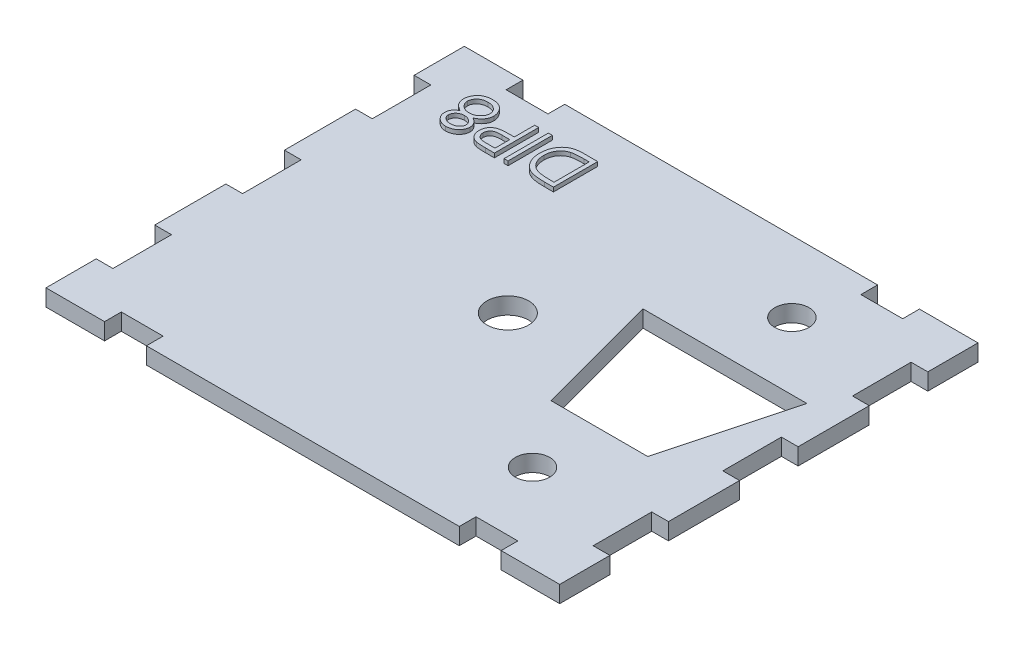
from build123d import *

# Parameters (mm, degrees)
SKETCH2_W           = 100
SKETCH2_H           = 50
BOSS_EXTRUDE1_DEPTH = 2
SKETCH12_W          = 9.8
SKETCH12_H          = 50
SKETCH12_W_2        = 8.8
CUT_EXTRUDE8_DEPTH  = 6
SKETCH13_W          = 2
SKETCH13_H          = 7
SKETCH13_W_2        = 5
SKETCH13_H_2        = 2
CUT_EXTRUDE10_DEPTH = 6
SKETCH15_W          = 6.543059906
SKETCH15_H          = 1
CUT_EXTRUDE13_DEPTH = 10
SKETCH16_R          = 2.5
CUT_EXTRUDE14_DEPTH = 10
SKETCH17_R          = 2.05
CUT_EXTRUDE15_DEPTH = 3.5
SKETCH22_W          = 0.474893163
SKETCH22_H          = 5.291666667
BOSS_EXTRUDE4_DEPTH = 0.5


with BuildPart() as part:
    # Sketch2 → Boss-Extrude1 (new body)
    with BuildSketch(Plane(origin=(0, 0, 0), x_dir=(1, 0, 0), z_dir=(0, 1, 0))):
        Rectangle(SKETCH2_W, SKETCH2_H)
    extrude(amount=BOSS_EXTRUDE1_DEPTH)

    # Sketch12 → Cut-Extrude8 (cut)
    with BuildSketch(Plane(origin=(0, 2, 0), x_dir=(1, 0, 0), z_dir=(0, 1, 0))):
        with Locations((-45.1, 0)):
            Rectangle(SKETCH12_W, SKETCH12_H)
        with Locations((45.6, 0)):
            Rectangle(SKETCH12_W_2, SKETCH12_H)
    extrude(amount=-CUT_EXTRUDE8_DEPTH, mode=Mode.SUBTRACT)

    # Sketch13 → Cut-Extrude10 (cut)
    with BuildSketch(Plane(origin=(0, 2, 0), x_dir=(1, 0, 0), z_dir=(0, 1, 0))):
        with Locations((-29.2, 0)):
            Rectangle(SKETCH13_W, SKETCH13_H)
        Polygon((-30.2, 12), (-30.2, 19), (-30.2, 25), (-40.2, 25), (-40.2, -25), (-30.2, -25), (-30.2, -19), (-30.2, -12), (-30.2, -3.5), (-30.2, 3.5), align=None)
        with Locations((-29.2, 15.5)):
            Rectangle(SKETCH13_W, SKETCH13_H)
        with Locations((21.7, -24)):
            Rectangle(SKETCH13_W_2, SKETCH13_H_2)
        with Locations((30.2, -15.5)):
            Rectangle(SKETCH13_W, SKETCH13_H)
        with Locations((30.2, 0)):
            Rectangle(SKETCH13_W, SKETCH13_H)
        with Locations((30.2, 15.5)):
            Rectangle(SKETCH13_W, SKETCH13_H)
        with Locations((21.7, 24)):
            Rectangle(SKETCH13_W_2, SKETCH13_H_2)
        with Locations((-29.2, -15.5)):
            Rectangle(SKETCH13_W, SKETCH13_H)
        Polygon((41.2, 25), (31.2, 25), (31.2, 19), (31.2, 12), (31.2, 3.5), (31.2, -3.5), (31.2, -12), (31.2, -19), (31.2, -25), (41.2, -25), align=None)
        with Locations((-20.7, 24)):
            Rectangle(SKETCH13_W_2, SKETCH13_H_2)
        with Locations((-20.7, -24)):
            Rectangle(SKETCH13_W_2, SKETCH13_H_2)
    extrude(amount=-CUT_EXTRUDE10_DEPTH, mode=Mode.SUBTRACT)

    # Sketch15 → Cut-Extrude13 (cut)
    with BuildSketch(Plane.XZ):
        Polygon((8.96933351, -7.5), (14.181143059, -7.5), (20.724202965, -7.5), (25.936012514, -7.5), (22.452673012, 5.5), (12.452673012, 5.5), align=None)
        Polygon((27.239237886, -8.5), (20.724202965, -8.5), (20.724202965, -7.5), (25.936012514, -7.5), (22.452673012, 5.5), (12.452673012, 5.5), (8.96933351, -7.5), (14.181143059, -7.5), (14.181143059, -8.5), (7.666108138, -8.5), (11.685346024, 6.5), (23.22, 6.5), align=None)
        with Locations((17.452673012, -8)):
            Rectangle(SKETCH15_W, SKETCH15_H)
    extrude(amount=-CUT_EXTRUDE13_DEPTH, mode=Mode.SUBTRACT)

    # Sketch16 → Cut-Extrude14 (cut)
    with BuildSketch(Plane(origin=(0, 0, 0), x_dir=(-1, 0, 0), z_dir=(0, -1, 0))):
        with Locations(Location((0, 0, 0), (0, 0, 90))):
            Circle(SKETCH16_R)
    extrude(amount=-CUT_EXTRUDE14_DEPTH, mode=Mode.SUBTRACT)

    # Sketch17 → Cut-Extrude15 (cut)
    with BuildSketch(Plane(origin=(0, 0, 0), x_dir=(-1, 0, 0), z_dir=(0, -1, 0))):
        with Locations(Location((-17.452672874, -14.5, 0), (0, 0, 90))):
            Circle(SKETCH17_R)
        with Locations(Location((-17.452672903, 16.5, 0), (0, 0, 90))):
            Circle(SKETCH17_R)
    extrude(amount=-CUT_EXTRUDE15_DEPTH, mode=Mode.SUBTRACT)

    # Sketch22 → Boss-Extrude4 (add)
    # profile 1 of 4: a face of its own
    with BuildSketch(Plane(origin=(0, 2, 0), x_dir=(1, 0, 0), z_dir=(0, 1, 0))):
        with BuildLine():
            add(Edge.make_bspline(
                [(-23.289435803, 17.591903377), (-23.332404905, 17.61448406), (-23.416471147, 17.658661691), (-23.536226688, 17.730009944), (-23.647999479, 17.802604298), (-23.749722211, 17.879054809), (-23.842392171, 17.957736407), (-23.926294543, 18.038440897), (-24.002331643, 18.120913039), (-24.067891265, 18.207273039), (-24.126059508, 18.295985161), (-24.175335145, 18.388142762), (-24.218340263, 18.482414147), (-24.252093921, 18.580230551), (-24.279961434, 18.680250068), (-24.299121538, 18.783814795), (-24.309429202, 18.890228595), (-24.31137761, 18.962147422), (-24.312364155, 18.998562365)],
                knots=[0, 0, 0, 0, 1.264219729, 2.473363326, 3.62979159, 4.734286947, 5.785533755, 6.79450939, 7.765315851, 8.704182021, 9.615576613, 10.525715488, 11.423813905, 12.311666436, 13.218214638, 14.126256791, 15.051260205, 16, 16, 16, 16], degree=3))
            add(Edge.make_bspline(
                [(-24.312364155, 18.998562365), (-24.311204378, 19.049512323), (-24.308908743, 19.150361407), (-24.288705392, 19.299170633), (-24.258862371, 19.444279836), (-24.213527962, 19.584044036), (-24.15774182, 19.719654049), (-24.087347083, 19.849282845), (-24.007897509, 19.976651469), (-23.944003353, 20.054992402), (-23.911673049, 20.094632744)],
                knots=[0, 0, 0, 0, 1.02531512, 2.029483338, 3.018748588, 4.004195107, 4.983200899, 5.966616707, 6.971112471, 8, 8, 8, 8], degree=3))
            add(Edge.make_bspline(
                [(-23.911673049, 20.094632744), (-23.869586951, 20.140887617), (-23.785934825, 20.232825779), (-23.642632065, 20.352191884), (-23.485360884, 20.452505849), (-23.314729833, 20.534257404), (-23.131195025, 20.597887215), (-22.934795566, 20.643611021), (-22.725148573, 20.669800885), (-22.581055777, 20.673586679), (-22.50713412, 20.675528845)],
                knots=[0, 0, 0, 0, 0.954267603, 1.896743057, 2.838368354, 3.796610408, 4.779680527, 5.799409237, 6.871065594, 8, 8, 8, 8], degree=3))
            add(Edge.make_bspline(
                [(-22.50713412, 20.675528845), (-22.436055991, 20.673781732), (-22.297745171, 20.670382028), (-22.096400606, 20.64747387), (-21.908487986, 20.606917675), (-21.733116378, 20.552556064), (-21.57198157, 20.480063565), (-21.424790588, 20.391208922), (-21.289386079, 20.287998182), (-21.170015852, 20.167947464), (-21.064068193, 20.039336519), (-20.970919412, 19.906693561), (-20.893932238, 19.770115131), (-20.827575478, 19.631678729), (-20.778193171, 19.488579337), (-20.743167977, 19.342285484), (-20.72116727, 19.193212775), (-20.718224786, 19.09262613), (-20.716744497, 19.04202357)],
                knots=[0, 0, 0, 0, 1.256864279, 2.445730223, 3.576845088, 4.651810441, 5.686528262, 6.692706664, 7.686234615, 8.689148594, 9.678739427, 10.630299996, 11.55097961, 12.448208961, 13.341360817, 14.221834469, 15.105450545, 16, 16, 16, 16], degree=3))
            add(Edge.make_bspline(
                [(-20.716744497, 19.04202357), (-20.717618412, 19.004892494), (-20.719345576, 18.931508382), (-20.731293861, 18.823089499), (-20.750519307, 18.717568868), (-20.776571554, 18.61452999), (-20.812202555, 18.514516547), (-20.854473631, 18.417012756), (-20.904236832, 18.322021441), (-20.963451698, 18.230988823), (-21.028691128, 18.140690304), (-21.106136334, 18.055609622), (-21.190624087, 17.970749255), (-21.287183971, 17.891269556), (-21.390601042, 17.810604383), (-21.505698429, 17.735495922), (-21.628638317, 17.660082318), (-21.716038773, 17.615019626), (-21.760873437, 17.591903377)],
                knots=[0, 0, 0, 0, 0.941575622, 1.860885767, 2.762557628, 3.660168386, 4.552890429, 5.45184204, 6.353736508, 7.268493418, 8.204037487, 9.175167802, 10.182660057, 11.238220596, 12.344046335, 13.507168087, 14.721227736, 16, 16, 16, 16], degree=3))
            add(Edge.make_bspline(
                [(-21.760873437, 17.591903377), (-21.699577858, 17.558340511), (-21.581078052, 17.493455028), (-21.422672491, 17.375729424), (-21.288489585, 17.245915039), (-21.179955341, 17.103816516), (-21.09426206, 16.95410414), (-21.033675933, 16.797566068), (-20.994129984, 16.635948219), (-20.990123942, 16.52574089), (-20.988112018, 16.470392293)],
                knots=[0, 0, 0, 0, 1.16701039, 2.256125286, 3.287752239, 4.277689688, 5.235169525, 6.160862735, 7.076343936, 8, 8, 8, 8], degree=3))
            add(Edge.make_bspline(
                [(-20.988112018, 16.470392293), (-20.99058901, 16.414004539), (-20.995568195, 16.30065532), (-21.035692113, 16.131877426), (-21.101573472, 15.966019636), (-21.18964704, 15.803466302), (-21.301731542, 15.651624337), (-21.434399213, 15.514337341), (-21.587483171, 15.395158449), (-21.757618679, 15.294413112), (-21.940381157, 15.212025645), (-22.133537089, 15.155780959), (-22.333643963, 15.118788779), (-22.46986568, 15.114612288), (-22.538935002, 15.112494657)],
                knots=[0, 0, 0, 0, 0.888724595, 1.786491426, 2.720083884, 3.697804067, 4.69440576, 5.687697823, 6.7000873, 7.744853364, 8.800284131, 9.853047784, 10.91141782, 12, 12, 12, 12], degree=3))
            add(Edge.make_bspline(
                [(-22.538935002, 15.112494657), (-22.606223043, 15.114671942), (-22.738907394, 15.1189653), (-22.934231025, 15.155126734), (-23.121279065, 15.21484513), (-23.299003181, 15.296181802), (-23.463621786, 15.397529675), (-23.610117107, 15.518020117), (-23.739685062, 15.65381121), (-23.846731579, 15.806153981), (-23.932605497, 15.968696476), (-23.994444609, 16.137306704), (-24.0335398, 16.30996329), (-24.038507636, 16.426729958), (-24.040996634, 16.485232704)],
                knots=[0, 0, 0, 0, 1.072634126, 2.115112298, 3.156050586, 4.19761425, 5.225177188, 6.230426315, 7.215180151, 8.209739481, 9.190420596, 10.139012357, 11.067603024, 12, 12, 12, 12], degree=3))
            add(Edge.make_bspline(
                [(-24.040996634, 16.485232704), (-24.038814594, 16.542644763), (-24.034529192, 16.655398782), (-23.998954414, 16.819531188), (-23.938110498, 16.972926268), (-23.856031863, 17.11794444), (-23.748301785, 17.252268321), (-23.617095434, 17.376565011), (-23.464115364, 17.493265493), (-23.348963868, 17.558289128), (-23.289435803, 17.591903377)],
                knots=[0, 0, 0, 0, 0.975463758, 1.915755378, 2.838359076, 3.772025586, 4.738400888, 5.753889765, 6.838863581, 8, 8, 8, 8], degree=3))
        make_face()
        with BuildLine():
            add(Edge.make_bspline(
                [(-22.512434267, 15.655229699), (-22.47531449, 15.656211427), (-22.402691974, 15.658132116), (-22.296228701, 15.668244), (-22.194907486, 15.687667345), (-22.098174266, 15.714277066), (-22.005697671, 15.747384889), (-21.919598353, 15.791005575), (-21.836982884, 15.839490149), (-21.760561541, 15.896360348), (-21.691380821, 15.958406963), (-21.629590243, 16.023204881), (-21.579250098, 16.092664313), (-21.535940626, 16.163310298), (-21.503777294, 16.238073053), (-21.480929572, 16.315315625), (-21.464760061, 16.395527264), (-21.463594687, 16.45017091), (-21.463005181, 16.477812499)],
                knots=[0, 0, 0, 0, 1.20353747, 2.354645537, 3.462130888, 4.543058862, 5.604822423, 6.639552563, 7.666902586, 8.706944258, 9.720926464, 10.677177239, 11.602682187, 12.496457588, 13.358248655, 14.231532794, 15.105417644, 16, 16, 16, 16], degree=3))
            add(Edge.make_bspline(
                [(-21.463005181, 16.477812499), (-21.464080303, 16.505438436), (-21.466204899, 16.560031256), (-21.481582796, 16.640972731), (-21.507294769, 16.719478164), (-21.542551413, 16.796280423), (-21.587796714, 16.871182371), (-21.642711, 16.944471028), (-21.709676985, 17.014208335), (-21.78362764, 17.082372873), (-21.864405646, 17.14517387), (-21.949288635, 17.201271158), (-22.03889609, 17.245991422), (-22.130544476, 17.285201955), (-22.226171939, 17.314614401), (-22.32511912, 17.335804335), (-22.427280324, 17.348911631), (-22.496495028, 17.350482111), (-22.531514796, 17.351276708)],
                knots=[0, 0, 0, 0, 0.873213166, 1.72559466, 2.594724523, 3.479581045, 4.391597569, 5.35687048, 6.368548091, 7.443976143, 8.534559525, 9.600545123, 10.654815915, 11.696401765, 12.749428718, 13.812189468, 14.893058657, 16, 16, 16, 16], degree=3))
            add(Edge.make_bspline(
                [(-22.531514796, 17.351276708), (-22.576496813, 17.349963671), (-22.666016561, 17.347350566), (-22.797934775, 17.322833119), (-22.926524557, 17.284755207), (-23.049352767, 17.230710492), (-23.164221069, 17.164816998), (-23.267889704, 17.087110128), (-23.356020332, 16.995764996), (-23.430997068, 16.896080311), (-23.489618261, 16.790338942), (-23.534523013, 16.683790582), (-23.560967949, 16.575557598), (-23.564405573, 16.503033178), (-23.566103471, 16.467212205)],
                knots=[0, 0, 0, 0, 1.076561449, 2.142489767, 3.202892658, 4.283174188, 5.348766409, 6.369549039, 7.375093932, 8.378927502, 9.349008457, 10.26378795, 11.142457041, 12, 12, 12, 12], degree=3))
            add(Edge.make_bspline(
                [(-23.566103471, 16.467212205), (-23.565314167, 16.442066926), (-23.563747511, 16.392157152), (-23.550314376, 16.318212536), (-23.529362787, 16.245904034), (-23.498822884, 16.175656129), (-23.46187911, 16.1058369), (-23.414787797, 16.03863664), (-23.360211652, 15.972021681), (-23.297362791, 15.908184689), (-23.22635654, 15.848252806), (-23.146618515, 15.796301252), (-23.058852377, 15.752979436), (-22.964234769, 15.716583757), (-22.861765786, 15.689552381), (-22.752327664, 15.669210289), (-22.634932936, 15.65776836), (-22.554152771, 15.656094273), (-22.512434267, 15.655229699)],
                knots=[0, 0, 0, 0, 0.814035228, 1.61574325, 2.427118093, 3.24780647, 4.092880925, 4.981933388, 5.900917883, 6.880367106, 7.87994501, 8.905470125, 9.95492938, 11.0455354, 12.184050453, 13.382997595, 14.64846247, 16, 16, 16, 16], degree=3))
        make_face(mode=Mode.SUBTRACT)
        with BuildLine():
            add(Edge.make_bspline(
                [(-22.543175119, 17.894011751), (-22.496116025, 17.894849043), (-22.403797565, 17.896491606), (-22.268545382, 17.914766395), (-22.138750223, 17.940223154), (-22.014810536, 17.978778768), (-21.897362521, 18.028944861), (-21.784753311, 18.088433254), (-21.678746335, 18.159735969), (-21.579815409, 18.241123996), (-21.489241489, 18.329322244), (-21.409489888, 18.422471375), (-21.342111092, 18.519306541), (-21.287432444, 18.619950223), (-21.245014196, 18.724180672), (-21.213708873, 18.832058714), (-21.195533045, 18.943885259), (-21.192943361, 19.019699148), (-21.191637659, 19.05792401)],
                knots=[0, 0, 0, 0, 1.140332253, 2.237053636, 3.304055028, 4.344690294, 5.377465719, 6.397042765, 7.428360044, 8.469453732, 9.499453352, 10.490108612, 11.438398528, 12.354680514, 13.261581007, 14.161901135, 15.073242693, 16, 16, 16, 16], degree=3))
            add(Edge.make_bspline(
                [(-21.191637659, 19.05792401), (-21.193736865, 19.105436245), (-21.197916883, 19.200044447), (-21.229889104, 19.339513735), (-21.282396734, 19.474495236), (-21.356058748, 19.603085246), (-21.445909182, 19.723724669), (-21.555139911, 19.83036229), (-21.681087775, 19.921562602), (-21.822718051, 19.997787354), (-21.977972565, 20.058158391), (-22.145891871, 20.101349747), (-22.325338543, 20.12849734), (-22.449086216, 20.131339079), (-22.512434267, 20.132793802)],
                knots=[0, 0, 0, 0, 0.899105568, 1.790333855, 2.694925079, 3.632758987, 4.588257081, 5.534574046, 6.511571685, 7.523527334, 8.572244311, 9.657983075, 10.801090915, 12, 12, 12, 12], degree=3))
            add(Edge.make_bspline(
                [(-22.512434267, 20.132793802), (-22.561946272, 20.131832001), (-22.658411534, 20.129958104), (-22.79919616, 20.113761674), (-22.931741394, 20.087305183), (-23.05731706, 20.051433018), (-23.174988471, 20.00388132), (-23.284595238, 19.944817552), (-23.387629904, 19.877353963), (-23.479688966, 19.797482909), (-23.563393287, 19.71201594), (-23.636711674, 19.622016397), (-23.698761577, 19.528385631), (-23.74877976, 19.431178451), (-23.788498975, 19.330752085), (-23.817132006, 19.226694282), (-23.834779351, 19.118596315), (-23.836565569, 19.045270882), (-23.837470993, 19.00810263)],
                knots=[0, 0, 0, 0, 1.224631902, 2.385975653, 3.500340538, 4.565441647, 5.612488581, 6.63322211, 7.641830068, 8.652595074, 9.641693811, 10.598750962, 11.520088299, 12.415429315, 13.298523938, 14.187139574, 15.081071174, 16, 16, 16, 16], degree=3))
            add(Edge.make_bspline(
                [(-23.837470993, 19.00810263), (-23.836110484, 18.971998254), (-23.833427799, 18.900806732), (-23.816156573, 18.795386006), (-23.786507588, 18.69311897), (-23.743274369, 18.594466875), (-23.69018178, 18.49828214), (-23.624595492, 18.40537225), (-23.547314869, 18.315479941), (-23.45852907, 18.230455999), (-23.362305315, 18.151855224), (-23.260329144, 18.082004429), (-23.152135819, 18.024914734), (-23.039868607, 17.976955371), (-22.922395756, 17.939580332), (-22.800283876, 17.913372465), (-22.673301633, 17.896900838), (-22.587040661, 17.89498566), (-22.543175119, 17.894011751)],
                knots=[0, 0, 0, 0, 0.917336384, 1.808827106, 2.706624561, 3.615530867, 4.539869921, 5.493819324, 6.499753197, 7.547410123, 8.613069608, 9.653934021, 10.682176708, 11.716048074, 12.752411263, 13.808993382, 14.885826486, 16, 16, 16, 16], degree=3))
        make_face(mode=Mode.SUBTRACT)
    # profile 2 of 4: a face of its own
    with BuildSketch(Plane(origin=(0, 2, 0), x_dir=(1, 0, 0), z_dir=(0, 1, 0))):
        with BuildLine():
            Line((-16.849757317, 15.248178417), (-17.887526081, 15.248178417))
            add(Edge.make_bspline(
                [(-17.887526081, 15.248178417), (-17.958904475, 15.24825688), (-18.095668647, 15.248407217), (-18.291785458, 15.252965225), (-18.469902552, 15.2590532), (-18.629635866, 15.267492491), (-18.771476871, 15.277465907), (-18.894783741, 15.29145411), (-19.000525689, 15.306059556), (-19.06388425, 15.320908588), (-19.092779486, 15.327680621)],
                knots=[0, 0, 0, 0, 1.415646017, 2.712440637, 3.8905458, 4.950247383, 5.884950622, 6.709939814, 7.411656543, 8, 8, 8, 8], degree=3))
            add(Edge.make_bspline(
                [(-19.092779486, 15.327680621), (-19.129357573, 15.337692681), (-19.201651829, 15.357480878), (-19.305827007, 15.39710916), (-19.404925695, 15.44411866), (-19.499362415, 15.497616299), (-19.587519359, 15.560128491), (-19.672148956, 15.628047242), (-19.7514764, 15.704119349), (-19.824303874, 15.788244656), (-19.891781673, 15.877667251), (-19.948265428, 15.974667362), (-19.998142805, 16.075880016), (-20.0370127, 16.18377635), (-20.06756593, 16.296932148), (-20.089817881, 16.415641918), (-20.104119685, 16.539649576), (-20.105476746, 16.624409671), (-20.106167574, 16.667557758)],
                knots=[0, 0, 0, 0, 0.999333726, 1.975119402, 2.933498163, 3.889020618, 4.832249799, 5.779334906, 6.747801194, 7.724875447, 8.710438469, 9.696133548, 10.679360639, 11.681339199, 12.714023775, 13.766351759, 14.862936069, 16, 16, 16, 16], degree=3))
            add(Edge.make_bspline(
                [(-20.106167574, 16.667557758), (-20.10553042, 16.711067015), (-20.104283785, 16.796195817), (-20.089321544, 16.920735628), (-20.069167564, 17.039750337), (-20.038177973, 17.152976053), (-19.997589872, 17.259740373), (-19.949976887, 17.361674855), (-19.892549407, 17.457045311), (-19.826562581, 17.546197977), (-19.753157194, 17.629216535), (-19.672643823, 17.705499379), (-19.585347512, 17.774599986), (-19.491545693, 17.836673267), (-19.390323898, 17.890279785), (-19.283217308, 17.938293806), (-19.169294957, 17.978617909), (-19.090460442, 17.999830026), (-19.050378311, 18.010614983)],
                knots=[0, 0, 0, 0, 1.121902311, 2.195077645, 3.232258892, 4.234102512, 5.217864754, 6.176164875, 7.132989551, 8.084763148, 9.034132444, 9.988522005, 10.94243251, 11.903244335, 12.886203696, 13.894208494, 14.929344452, 16, 16, 16, 16], degree=3))
            add(Edge.make_bspline(
                [(-19.050378311, 18.010614983), (-19.017225893, 18.017659712), (-18.944570441, 18.033098645), (-18.824921685, 18.050451574), (-18.685544292, 18.064682872), (-18.526912485, 18.077963633), (-18.348656338, 18.085000776), (-18.151184687, 18.09326353), (-17.933829219, 18.097162272), (-17.782230557, 18.097408721), (-17.703080969, 18.097537392)],
                knots=[0, 0, 0, 0, 0.601372724, 1.317943291, 2.144091499, 3.08771165, 4.142394186, 5.309582461, 6.595334295, 8, 8, 8, 8], degree=3))
            Line((-17.703080969, 18.097537392), (-17.32465048, 18.097537392))
            Line((-17.32465048, 18.097537392), (-17.32465048, 20.539845084))
            Line((-17.32465048, 20.539845084), (-16.849757317, 20.539845084))
            Line((-16.849757317, 20.539845084), (-16.849757317, 15.248178417))
        make_face()
        with BuildLine():
            Line((-17.32465048, 15.79091346), (-17.32465048, 17.554802349))
            Line((-17.32465048, 17.554802349), (-18.251116158, 17.566462672))
            add(Edge.make_bspline(
                [(-18.251116158, 17.566462672), (-18.296352998, 17.5664925), (-18.383681785, 17.566550082), (-18.510171515, 17.560421484), (-18.627242279, 17.553754261), (-18.735066925, 17.542971778), (-18.833153313, 17.529820509), (-18.921738923, 17.512237197), (-19.001530711, 17.494303354), (-19.093442015, 17.463184955), (-19.196392314, 17.4162389), (-19.308129847, 17.346119114), (-19.403600406, 17.257785816), (-19.485518732, 17.157394105), (-19.550269573, 17.045594913), (-19.597197314, 16.926308405), (-19.625841034, 16.799987531), (-19.629441306, 16.713641524), (-19.631274411, 16.669677816)],
                knots=[0, 0, 0, 0, 1.160501667, 2.240324542, 3.248665471, 4.168823117, 5.020172044, 5.786515869, 6.485785279, 7.116517804, 8.272762037, 9.381837012, 10.485674779, 11.594342068, 12.695271952, 13.786226926, 14.872841088, 16, 16, 16, 16], degree=3))
            add(Edge.make_bspline(
                [(-19.631274411, 16.669677816), (-19.629359524, 16.627138412), (-19.625552964, 16.54257534), (-19.597433922, 16.418581872), (-19.549772594, 16.300651465), (-19.485465943, 16.189738386), (-19.405510669, 16.089613502), (-19.311938821, 16.003248829), (-19.206206234, 15.933346739), (-19.108619451, 15.886813583), (-19.021286965, 15.859525505), (-18.945795973, 15.839824894), (-18.860125246, 15.826237802), (-18.765085548, 15.81323751), (-18.660798562, 15.802743445), (-18.546601151, 15.795456031), (-18.422873698, 15.791235826), (-18.336981928, 15.791023517), (-18.292457304, 15.79091346)],
                knots=[0, 0, 0, 0, 1.12039168, 2.227199994, 3.330242575, 4.460839274, 5.593542475, 6.693949254, 7.801736126, 8.92216649, 9.528704869, 10.210659466, 10.975987387, 11.81211542, 12.738540127, 13.736887663, 14.826846554, 16, 16, 16, 16], degree=3))
            Line((-18.292457304, 15.79091346), (-17.32465048, 15.79091346))
        make_face(mode=Mode.SUBTRACT)
    # profile 3 of 4: a face of its own
    with BuildSketch(Plane(origin=(0, 2, 0), x_dir=(1, 0, 0), z_dir=(0, 1, 0))):
        with Locations((-15.458998771, 17.89401175)):
            Rectangle(SKETCH22_W, SKETCH22_H)
    # profile 4 of 4: a face of its own
    with BuildSketch(Plane(origin=(0, 2, 0), x_dir=(1, 0, 0), z_dir=(0, 1, 0))):
        with BuildLine():
            Line((-9.794201762, 20.539845084), (-9.794201762, 15.248178417))
            Line((-9.794201762, 15.248178417), (-10.862711377, 15.248178417))
            add(Edge.make_bspline(
                [(-10.862711377, 15.248178417), (-10.955646826, 15.248845718), (-11.135197631, 15.250134939), (-11.394656719, 15.258355989), (-11.634380243, 15.272752196), (-11.854232067, 15.294126465), (-12.054565401, 15.319781578), (-12.235059386, 15.352408477), (-12.396006529, 15.39077992), (-12.494989894, 15.423507319), (-12.541797916, 15.438983706)],
                knots=[0, 0, 0, 0, 1.314317071, 2.539253741, 3.67075822, 4.709970291, 5.662644612, 6.526156501, 7.303037452, 8, 8, 8, 8], degree=3))
            add(Edge.make_bspline(
                [(-12.541797916, 15.438983706), (-12.60302758, 15.462306224), (-12.724098423, 15.508422383), (-12.896386852, 15.595547119), (-13.059127226, 15.693859614), (-13.211034541, 15.805613833), (-13.352443516, 15.929381688), (-13.485133382, 16.064161799), (-13.605300833, 16.21355234), (-13.717090477, 16.372917778), (-13.814935421, 16.543708371), (-13.901215858, 16.722503207), (-13.974886252, 16.908955371), (-14.032368948, 17.104425318), (-14.079859589, 17.307035637), (-14.111724644, 17.518320336), (-14.132891318, 17.737047608), (-14.135008075, 17.885479957), (-14.136082104, 17.960793602)],
                knots=[0, 0, 0, 0, 0.984696416, 1.947063185, 2.89840987, 3.841051395, 4.778753227, 5.721858861, 6.681155121, 7.65838316, 8.646299769, 9.637283673, 10.641736726, 11.657050558, 12.698485921, 13.768600492, 14.86780186, 16, 16, 16, 16], degree=3))
            add(Edge.make_bspline(
                [(-14.136082104, 17.960793602), (-14.135130523, 18.026200252), (-14.133255335, 18.155090889), (-14.116438052, 18.345051132), (-14.09194744, 18.529361241), (-14.054204692, 18.707211928), (-14.007827279, 18.879800613), (-13.950585726, 19.046310112), (-13.882739951, 19.206853596), (-13.804058122, 19.360155912), (-13.71790473, 19.505844287), (-13.624026466, 19.641610381), (-13.525637661, 19.768951073), (-13.4191499, 19.884989597), (-13.308088882, 19.993339426), (-13.188677268, 20.089194152), (-13.064653977, 20.177003811), (-12.932292989, 20.254101774), (-12.790508332, 20.322682703), (-12.63559639, 20.38059971), (-12.468122548, 20.430441608), (-12.286977089, 20.470152222), (-12.092764151, 20.502160991), (-11.884957268, 20.523477188), (-11.66394557, 20.53793223), (-11.512181182, 20.539195085), (-11.434067213, 20.539845084)],
                knots=[0, 0, 0, 0, 1.105894396, 2.179280415, 3.222964075, 4.248423888, 5.251546139, 6.243661943, 7.223682738, 8.196462441, 9.155694589, 10.083899862, 10.986397372, 11.874737962, 12.745335529, 13.607670254, 14.461432187, 15.313100333, 16.195087267, 17.121790994, 18.106827133, 19.14775296, 20.255889161, 21.433815148, 22.679170477, 24, 24, 24, 24], degree=3))
            Line((-11.434067213, 20.539845084), (-9.794201762, 20.539845084))
        make_face()
        with BuildLine():
            Line((-10.269094924, 19.997110041), (-10.876491759, 19.997110041))
            add(Edge.make_bspline(
                [(-10.876491759, 19.997110041), (-10.963771558, 19.996734943), (-11.131642575, 19.996013492), (-11.373030261, 19.98968284), (-11.593586015, 19.979338482), (-11.793341154, 19.964861876), (-11.972182893, 19.945708137), (-12.130484991, 19.924352629), (-12.267728537, 19.897746959), (-12.350776614, 19.873630628), (-12.389153685, 19.86248631)],
                knots=[0, 0, 0, 0, 1.375205317, 2.645023457, 3.804390687, 4.853969522, 5.800190428, 6.637939096, 7.370582563, 8, 8, 8, 8], degree=3))
            add(Edge.make_bspline(
                [(-12.389153685, 19.86248631), (-12.437457592, 19.845476297), (-12.532911669, 19.811862553), (-12.670300372, 19.750524854), (-12.798499649, 19.677957626), (-12.919646715, 19.596817328), (-13.032962998, 19.505851075), (-13.137923739, 19.404769574), (-13.235357997, 19.294743066), (-13.323705759, 19.175400814), (-13.4036093, 19.048066979), (-13.472645697, 18.912883401), (-13.530842597, 18.770608682), (-13.578589285, 18.62173782), (-13.61581533, 18.466182211), (-13.64202393, 18.30355149), (-13.658265092, 18.133909881), (-13.660203698, 18.018425372), (-13.661188941, 17.959733572)],
                knots=[0, 0, 0, 0, 0.998420628, 1.972994, 2.929372424, 3.86770908, 4.81360496, 5.759023883, 6.706048443, 7.676227424, 8.651287839, 9.634325482, 10.632389399, 11.645655052, 12.680158286, 13.74837235, 14.855672678, 16, 16, 16, 16], degree=3))
            add(Edge.make_bspline(
                [(-13.661188941, 17.959733572), (-13.660412073, 17.897846419), (-13.658885907, 17.776268559), (-13.639735283, 17.597872612), (-13.611689968, 17.426319709), (-13.571348971, 17.261486341), (-13.519231881, 17.103586959), (-13.456869559, 16.951729499), (-13.38115191, 16.807868222), (-13.295431527, 16.670784678), (-13.199194698, 16.542554911), (-13.092868326, 16.4246812), (-12.977573557, 16.316943975), (-12.85384175, 16.219171701), (-12.719942925, 16.133103123), (-12.578142913, 16.05653786), (-12.426444272, 15.991483459), (-12.320892138, 15.956895335), (-12.267250306, 15.939317573)],
                knots=[0, 0, 0, 0, 1.122272916, 2.204715076, 3.251197285, 4.274229216, 5.279697671, 6.265416158, 7.248880903, 8.225321784, 9.195852973, 10.153576302, 11.101466393, 12.055578741, 13.010401466, 13.985536859, 14.976245305, 16, 16, 16, 16], degree=3))
            add(Edge.make_bspline(
                [(-12.267250306, 15.939317573), (-12.222874168, 15.927046307), (-12.128518323, 15.900954229), (-11.974546753, 15.872492059), (-11.801259563, 15.847387638), (-11.607887395, 15.826133221), (-11.394650678, 15.810882152), (-11.161385411, 15.799435045), (-10.907990771, 15.791714303), (-10.732333845, 15.791187091), (-10.641165237, 15.79091346)],
                knots=[0, 0, 0, 0, 0.674548936, 1.434276114, 2.292660221, 3.240891867, 4.284742987, 5.42552168, 6.663806718, 8, 8, 8, 8], degree=3))
            Line((-10.641165237, 15.79091346), (-10.269094924, 15.79091346))
            Line((-10.269094924, 15.79091346), (-10.269094924, 19.997110041))
        make_face(mode=Mode.SUBTRACT)
    extrude(amount=BOSS_EXTRUDE4_DEPTH)


solid = part.part
